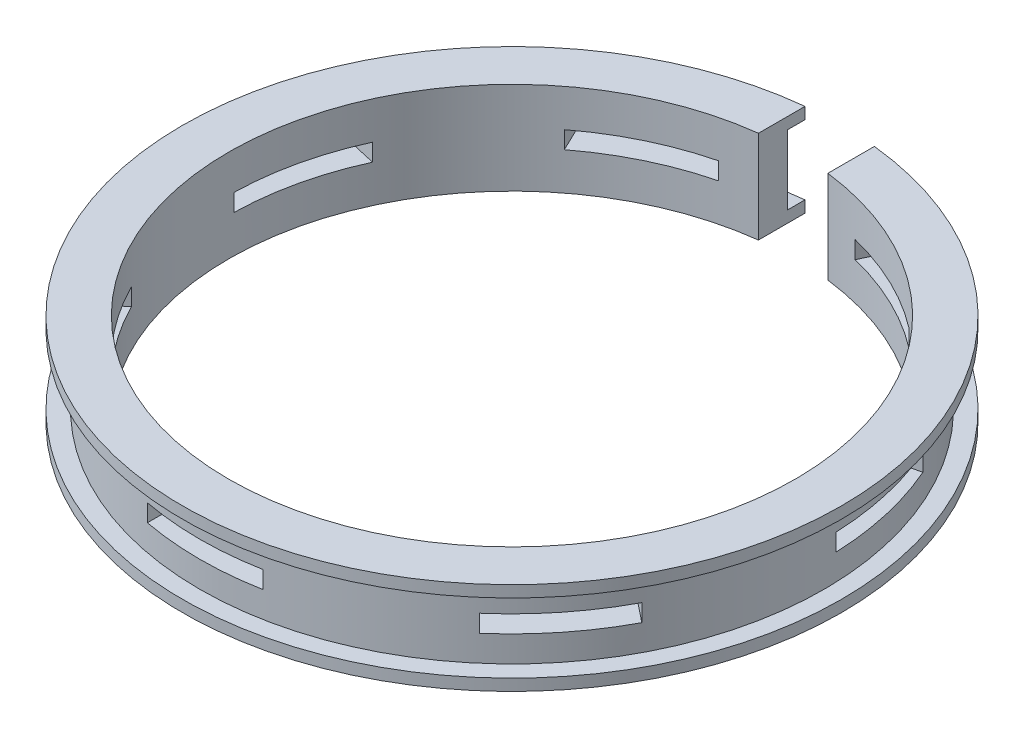
from build123d import *

# Parameters (mm, degrees)
SKETCH_2_W               = 6
SKETCH_2_H               = 57
CUT_EXTRUDE_1_DEPTH      = 42.091361623
SKETCH_3_W               = 10
SKETCH_3_H               = 1.5
CUT_EXTRUDE_2_DEPTH      = 42.091361623
PATTERN_CIRCULAR_1_COUNT = 7


with BuildPart() as part:
    # Эскиз1 → Повернуть1 (revolve)
    with BuildSketch(Plane.XY, mode=Mode.PRIVATE) as revolve_1_sk:
        Polygon((24.5, 0), (24.5, 8), (28.5, 8), (28.5, 7), (27, 7), (27, 1), (28.5, 1), (28.5, 0), align=None)
    revolve(revolve_1_sk.sketch.rotate(Axis((0, 0, 0), (0, 1, 0)), 90), axis=Axis((0, 0, 0), (0, 1, 0)))

    # Эскиз2 → Вырез-Вытянуть1 (cut, through all)
    with BuildSketch(Plane(origin=(0, 0, 0), x_dir=(1, 0, 0), z_dir=(0, 1, 0))):
        with Locations((0, 28.5)):
            Rectangle(SKETCH_2_W, SKETCH_2_H)
    extrude(amount=CUT_EXTRUDE_1_DEPTH, mode=Mode.SUBTRACT)

    # Эскиз3 → Вырез-Вытянуть2 (cut, through all)
    with BuildSketch(Plane.XY):
        with Locations((0, 4)):
            Rectangle(SKETCH_3_W, SKETCH_3_H)
    cut_extrude_2 = extrude(amount=CUT_EXTRUDE_2_DEPTH, mode=Mode.SUBTRACT)

    # Круговой массив1: Вырез-Вытянуть2 ×7 about axis
    pattern_circular_1_axis = Axis((0, 0, 0), (0, 1, 0))
    for i in range(1, PATTERN_CIRCULAR_1_COUNT):
        add(cut_extrude_2.rotate(pattern_circular_1_axis, i * 360 / PATTERN_CIRCULAR_1_COUNT), mode=Mode.SUBTRACT)


solid = part.part
